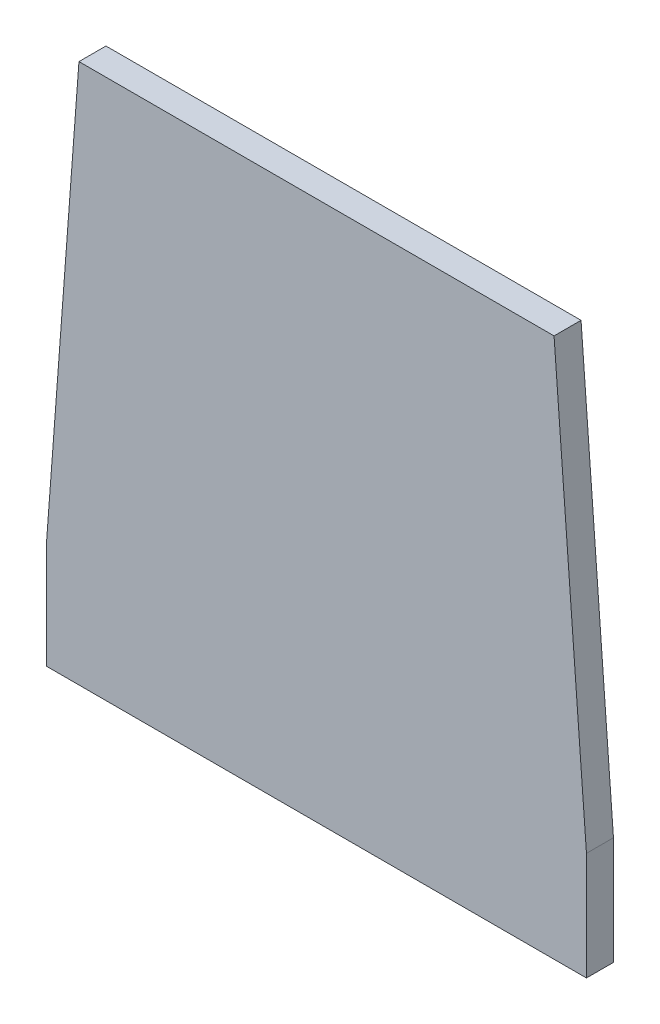
from build123d import *

# Parameters (mm, degrees)
SKETCH1_W           = 127
SKETCH1_H           = 25.4
BOSS_EXTRUDE1_DEPTH = 6.35
SKETCH2_R           = 3.175
CUT_EXTRUDE1_DEPTH  = 3.175


with BuildPart() as part:
    # Sketch1 → Boss-Extrude1 (new body)
    with BuildSketch(Plane.XY):
        Polygon((55.88, 25.4), (63.5, -76.2), (-63.5, -76.2), (-55.88, 25.4), align=None)
        with Locations((0, -88.9)):
            Rectangle(SKETCH1_W, SKETCH1_H)
    extrude(amount=BOSS_EXTRUDE1_DEPTH)

    # Sketch2 → Cut-Extrude1 (cut)
    with BuildSketch(Plane.XY.offset(3.175)):
        with Locations((-25.4, -88.9)):
            Circle(SKETCH2_R)
        with Locations((25.4, -88.9)):
            Circle(SKETCH2_R)
    extrude(amount=-CUT_EXTRUDE1_DEPTH, mode=Mode.SUBTRACT)


solid = part.part
